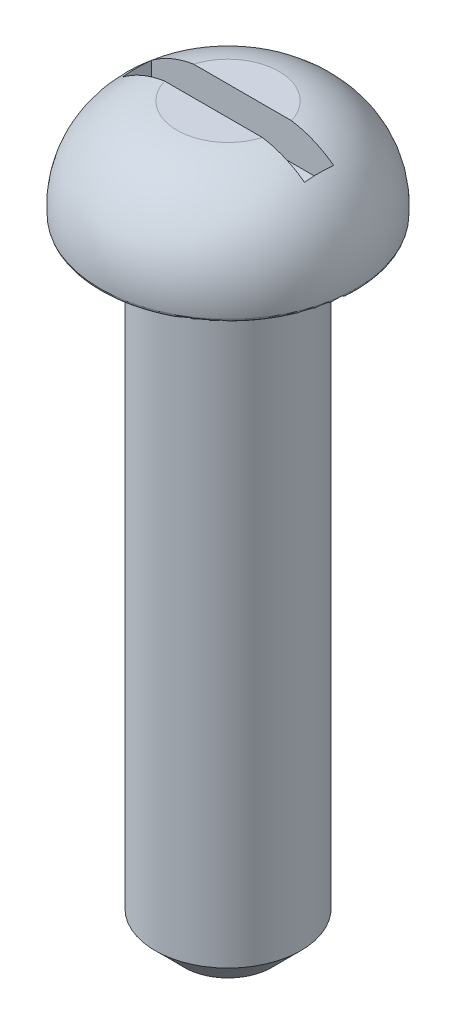
from build123d import *

# Parameters (mm, degrees)
FILLET_1_R          = 0.1
SKETCH_3_W          = 5
SKETCH_3_H          = 0.8
CUT_EXTRUDE_2_DEPTH = 1


with BuildPart() as part:
    # Эскиз1 → Повернуть1 (revolve)
    with BuildSketch(Plane.XY):
        with BuildLine():
            Line((3.5, 17.2), (2, 17.2))
            Line((2, 17.2), (2, 0.8))
            Line((2, 0.8), (1.2, 0))
            Line((1.2, 0), (0, 0))
            Line((0, 0), (0, 20))
            Line((0, 20), (1.4, 20))
            ThreePointArc((1.4, 20), (3.015564437, 19.024173328), (3.5, 17.2))
        make_face()
    revolve(axis=Axis((0, 0, 0), (0, 1, 0)))

    # Скругление1
    fillet_1_edges = [part.edges().sort_by_distance(p)[0] for p in [
        (-3.5, 17.2, 0),
    ]]
    fillet(fillet_1_edges, radius=FILLET_1_R)

    # Эскиз3 → Вырез-Вытянуть2 (cut)
    with BuildSketch(Plane(origin=(0, 20, 0), x_dir=(-1, 0, 0), z_dir=(0, 1, 0))):
        Rectangle(SKETCH_3_W, SKETCH_3_H)
    extrude(amount=-CUT_EXTRUDE_2_DEPTH, mode=Mode.SUBTRACT)


solid = part.part
